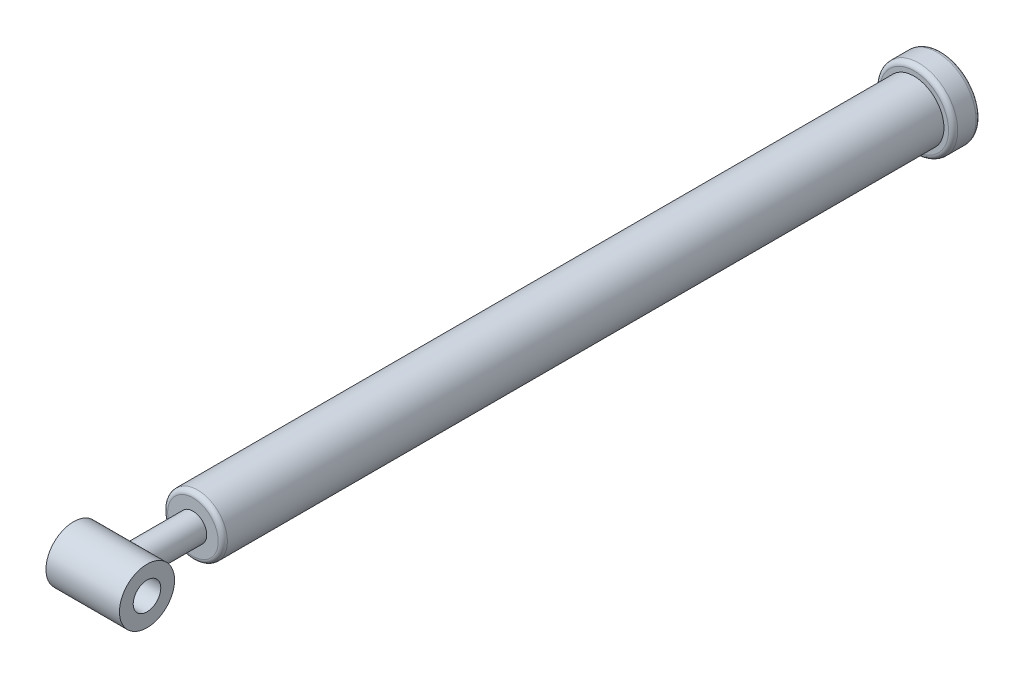
from build123d import *

# Parameters (mm, degrees)
SKETCH1_R           = 42.5
SKETCH1_R_2         = 20
BOSS_EXTRUDE1_DEPTH = 30
BOSS_EXTRUDE2_START = 780
SKETCH2_R           = 32.5
SKETCH2_R_2         = 20
BOSS_EXTRUDE2_DEPTH = 780
BOSS_EXTRUDE3_START = 5
SKETCH3_R           = 32.5
BOSS_EXTRUDE3_DEPTH = 5
SKETCH4_R           = 15
BOSS_EXTRUDE4_DEPTH = 65
SKETCH5_R           = 30
SKETCH5_R_2         = 15
BOSS_EXTRUDE5_DEPTH = 40
FILLET1_R           = 5


with BuildPart() as part:
    # Sketch1 → Boss-Extrude1 (new body)
    with BuildSketch(Plane.XY):
        Circle(SKETCH1_R)
        Circle(SKETCH1_R_2, mode=Mode.SUBTRACT)
    extrude(amount=-BOSS_EXTRUDE1_DEPTH)

    # Sketch2 → Boss-Extrude2 (add)
    with BuildSketch(Plane.XY.offset(BOSS_EXTRUDE2_START)):
        Circle(SKETCH2_R)
        Circle(SKETCH2_R_2, mode=Mode.SUBTRACT)
    extrude(amount=-BOSS_EXTRUDE2_DEPTH)

    # Sketch3 → Boss-Extrude3 (add)
    with BuildSketch(Plane.XY.offset(780).offset(BOSS_EXTRUDE3_START)):
        Circle(SKETCH3_R)
    extrude(amount=-BOSS_EXTRUDE3_DEPTH)

    # Sketch4 → Boss-Extrude4 (add)
    with BuildSketch(Plane.XY.offset(785)):
        Circle(SKETCH4_R)
    extrude(amount=BOSS_EXTRUDE4_DEPTH)

    # Sketch5 → Boss-Extrude5 (add, symmetric)
    with BuildSketch(Plane(origin=(0, 0, 0), x_dir=(0, 0, -1), z_dir=(1, 0, 0))):
        with Locations((-875, 0)):
            Circle(SKETCH5_R)
        with Locations((-875, 0)):
            Circle(SKETCH5_R_2, mode=Mode.SUBTRACT)
    extrude(amount=BOSS_EXTRUDE5_DEPTH, both=True)

    # Fillet1
    fillet1_edges = [part.edges().sort_by_distance(p)[0] for p in [
        (-32.5, 0, 785),
        (-42.5, 0, 0),
        (-42.5, 0, -30),
    ]]
    fillet(fillet1_edges, radius=FILLET1_R)


solid = part.part
